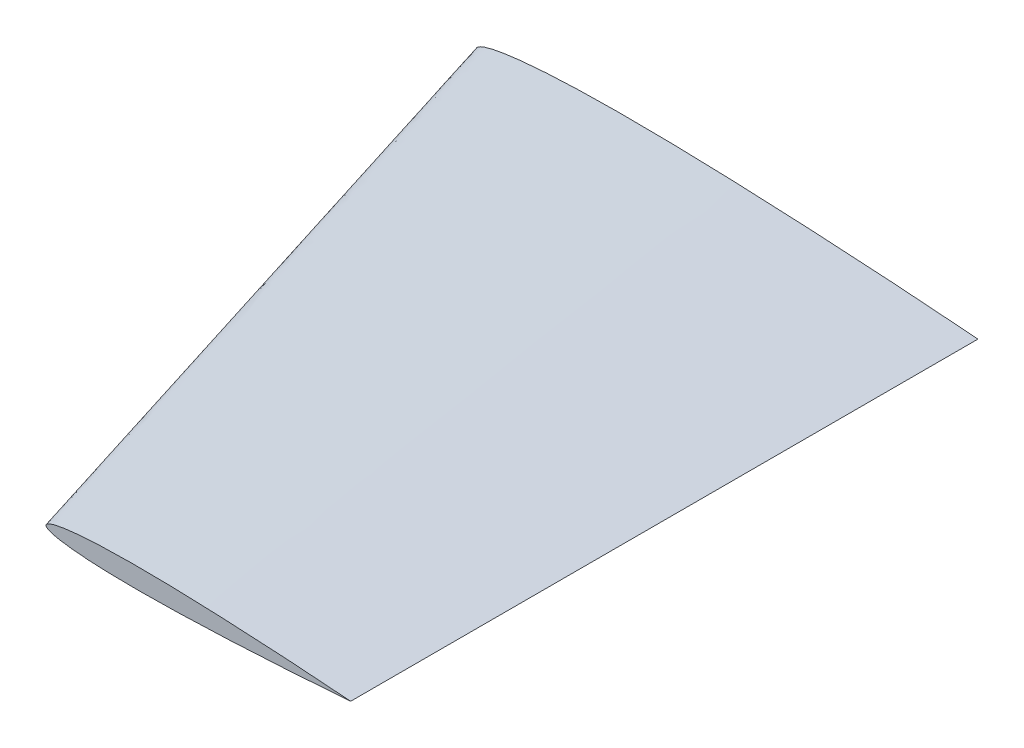
from build123d import *


with BuildPart() as part:
    # нерв1 → По сечениям1 section 0
    with BuildSketch(Plane.XY):
        with BuildLine():
            add(Edge.make_bspline(
                [(0, 0), (0.066646533, -0.300327221), (0.220118621, -0.991913766), (1.207915471, -1.818791265), (2.598597736, -2.607301109), (4.546714277, -3.365105983), (7.004632242, -4.097551663), (9.987947916, -4.797726988), (13.479893141, -5.462475269), (17.470424185, -6.085824188), (21.943527985, -6.664374922), (26.881916231, -7.193782765), (32.266470883, -7.670167284), (38.075817074, -8.090755343), (44.287387024, -8.452247623), (50.876432941, -8.753613633), (57.81725763, -8.993112623), (65.082247917, -9.170073671), (72.64284552, -9.285223373), (80.46919796, -9.339560237), (88.530513531, -9.334786425), (96.79487635, -9.272994239), (105.229626265, -9.157395726), (113.801545369, -8.991353507), (122.476931474, -8.778200356), (131.22146838, -8.522939041), (140.000603953, -8.228979864), (148.779723415, -7.900978204), (157.524225798, -7.543694044), (166.199521999, -7.160257872), (174.771348337, -6.756689382), (183.205960174, -6.335952936), (191.470121888, -5.901945974), (199.531216413, -5.459578572), (207.357290435, -5.012110272), (214.917551941, -4.563316484), (222.182116321, -4.116639832), (229.122475741, -3.676441417), (235.710916968, -3.245099817), (241.921757948, -2.827375405), (247.73025644, -2.426629026), (253.113660092, -2.045299058), (258.050601159, -1.688141593), (262.5217746, -1.35751626), (266.509324011, -1.057363689), (269.997602529, -0.789959213), (272.972836194, -0.558626284), (275.423392219, -0.366201697), (277.339373331, -0.213600606), (278.713327636, -0.103768487), (279.539880848, -0.037322177), (279.907880448, -0.0074722), (280, 0)],
                knots=[0, 0, 0, 0, 0.003198495, 0.00736542, 0.013021967, 0.020363842, 0.029458972, 0.040319396, 0.052931016, 0.067263992, 0.083271473, 0.100901245, 0.120088157, 0.140764935, 0.162851426, 0.186267029, 0.210920603, 0.236719652, 0.263562421, 0.29134679, 0.31996535, 0.349305423, 0.379252048, 0.409688994, 0.440496812, 0.471554783, 0.502739083, 0.533927662, 0.564998336, 0.59582691, 0.626291899, 0.656272958, 0.685652615, 0.714314232, 0.742143266, 0.769030095, 0.794870025, 0.81955827, 0.842999124, 0.865097589, 0.885768746, 0.904927723, 0.922501305, 0.938417454, 0.952614935, 0.965034623, 0.975629178, 0.984356351, 0.991180052, 0.996072937, 0.999016957, 1, 1, 1, 1], degree=3))
            add(Edge.make_bspline(
                [(280, 0), (279.907880448, 0.0074722), (279.539880848, 0.037322177), (278.713327636, 0.103768487), (277.339373331, 0.213600606), (275.423392219, 0.366201697), (272.972836194, 0.558626284), (269.997602529, 0.789959213), (266.509324011, 1.057363689), (262.5217746, 1.35751626), (258.050601159, 1.688141593), (253.113660092, 2.045299058), (247.73025644, 2.426629026), (241.921757948, 2.827375405), (235.710916968, 3.245099817), (229.122475741, 3.676441417), (222.182116321, 4.116639832), (214.917551941, 4.563316484), (207.357290435, 5.012110272), (199.531216413, 5.459578572), (191.470121888, 5.901945974), (183.205960174, 6.335952936), (174.771348337, 6.756689382), (166.199521999, 7.160257872), (157.524225798, 7.543694044), (148.779723415, 7.900978204), (140.000603953, 8.228979864), (131.22146838, 8.522939041), (122.476931474, 8.778200356), (113.801545369, 8.991353507), (105.229626265, 9.157395726), (96.79487635, 9.272994239), (88.530513531, 9.334786425), (80.46919796, 9.339560237), (72.64284552, 9.285223373), (65.082247917, 9.170073671), (57.81725763, 8.993112623), (50.876432941, 8.753613633), (44.287387024, 8.452247623), (38.075817074, 8.090755343), (32.266470883, 7.670167284), (26.881916231, 7.193782765), (21.943527985, 6.664374922), (17.470424185, 6.085824188), (13.479893141, 5.462475269), (9.987947916, 4.797726988), (7.004632242, 4.097551663), (4.546714277, 3.365105983), (2.598597736, 2.607301109), (1.207915471, 1.818791265), (0.220118621, 0.991913766), (0.066646533, 0.300327221), (0, 0)],
                knots=[0, 0, 0, 0, 0.000983043, 0.003927063, 0.008819948, 0.015643649, 0.024370822, 0.034965377, 0.047385065, 0.061582546, 0.077498695, 0.095072277, 0.114231254, 0.134902411, 0.157000876, 0.18044173, 0.205129975, 0.230969905, 0.257856734, 0.285685768, 0.314347385, 0.343727042, 0.373708101, 0.40417309, 0.435001664, 0.466072338, 0.497260917, 0.528445217, 0.559503188, 0.590311006, 0.620747952, 0.650694577, 0.68003465, 0.70865321, 0.736437579, 0.763280348, 0.789079397, 0.813732971, 0.837148574, 0.859235065, 0.879911843, 0.899098755, 0.916728527, 0.932736008, 0.947068984, 0.959680604, 0.970541028, 0.979636158, 0.986978033, 0.99263458, 0.996801505, 1, 1, 1, 1], degree=3))
        make_face()
    # нерв 2 → По сечениям1 section 1
    with BuildSketch(Plane.XY.offset(175)):
        with BuildLine():
            add(Edge.make_bspline(
                [(55, 0), (55.05355525, -0.241334374), (55.176881034, -0.797073562), (55.970646361, -1.461528695), (57.088158895, -2.095152677), (58.653609687, -2.704103022), (60.628722338, -3.292675444), (63.026029575, -3.85531633), (65.832056988, -4.389489056), (69.03873372, -4.890394437), (72.633192131, -5.355301277), (76.601539829, -5.780718293), (80.928414103, -6.163527282), (85.59663872, -6.50149983), (90.588078859, -6.791984697), (95.882847899, -7.034153812), (101.46029631, -7.226608358), (107.298234933, -7.3688092), (113.37371515, -7.46134021), (119.66274836, -7.505003762), (126.140591231, -7.501167663), (132.781597067, -7.451513228), (139.559521106, -7.358621566), (146.447670386, -7.225194782), (153.418962791, -7.053911), (160.445822806, -6.8487903), (167.500485319, -6.612573105), (174.555134887, -6.349000342), (181.581967159, -6.061897), (188.553187321, -5.753778647), (195.441262056, -5.429482539), (202.21907514, -5.091390752), (208.859919374, -4.742635158), (215.337584618, -4.387161352), (221.6263941, -4.027588612), (227.701604239, -3.666950746), (233.539200615, -3.308014151), (239.116275149, -2.954283282), (244.410558278, -2.607669496), (249.401412637, -2.271998093), (254.068956068, -1.949969753), (258.394905431, -1.643543886), (262.362090217, -1.356542351), (265.954997447, -1.09086128), (269.159278223, -0.84966725), (271.962359175, -0.634788654), (274.353171942, -0.448896121), (276.322368747, -0.29426922), (277.861996427, -0.171643344), (278.96606685, -0.083385391), (279.630261396, -0.029991035), (279.92597536, -0.006004446), (280, 0)],
                knots=[0, 0, 0, 0, 0.003198495, 0.00736542, 0.013021967, 0.020363842, 0.029458972, 0.040319396, 0.052931016, 0.067263992, 0.083271473, 0.100901245, 0.120088157, 0.140764935, 0.162851426, 0.186267029, 0.210920603, 0.236719652, 0.263562421, 0.29134679, 0.31996535, 0.349305423, 0.379252048, 0.409688994, 0.440496812, 0.471554783, 0.502739083, 0.533927662, 0.564998336, 0.59582691, 0.626291899, 0.656272958, 0.685652615, 0.714314232, 0.742143266, 0.769030095, 0.794870025, 0.81955827, 0.842999124, 0.865097589, 0.885768746, 0.904927723, 0.922501305, 0.938417454, 0.952614935, 0.965034623, 0.975629178, 0.984356351, 0.991180052, 0.996072937, 0.999016957, 1, 1, 1, 1], degree=3))
            add(Edge.make_bspline(
                [(280, 0), (279.92597536, 0.006004446), (279.630261396, 0.029991035), (278.96606685, 0.083385391), (277.861996427, 0.171643344), (276.322368747, 0.29426922), (274.353171942, 0.448896121), (271.962359175, 0.634788654), (269.159278223, 0.84966725), (265.954997447, 1.09086128), (262.362090217, 1.356542351), (258.394905431, 1.643543886), (254.068956068, 1.949969753), (249.401412637, 2.271998093), (244.410558278, 2.607669496), (239.116275149, 2.954283282), (233.539200615, 3.308014151), (227.701604239, 3.666950746), (221.6263941, 4.027588612), (215.337584618, 4.387161352), (208.859919374, 4.742635158), (202.21907514, 5.091390752), (195.441262056, 5.429482539), (188.553187321, 5.753778647), (181.581967159, 6.061897), (174.555134887, 6.349000342), (167.500485319, 6.612573105), (160.445822806, 6.8487903), (153.418962791, 7.053911), (146.447670386, 7.225194782), (139.559521106, 7.358621566), (132.781597067, 7.451513228), (126.140591231, 7.501167663), (119.66274836, 7.505003762), (113.37371515, 7.46134021), (107.298234933, 7.3688092), (101.46029631, 7.226608358), (95.882847899, 7.034153812), (90.588078859, 6.791984697), (85.59663872, 6.50149983), (80.928414103, 6.163527282), (76.601539829, 5.780718293), (72.633192131, 5.355301277), (69.03873372, 4.890394437), (65.832056988, 4.389489056), (63.026029575, 3.85531633), (60.628722338, 3.292675444), (58.653609687, 2.704103022), (57.088158895, 2.095152677), (55.970646361, 1.461528695), (55.176881034, 0.797073562), (55.05355525, 0.241334374), (55, 0)],
                knots=[0, 0, 0, 0, 0.000983043, 0.003927063, 0.008819948, 0.015643649, 0.024370822, 0.034965377, 0.047385065, 0.061582546, 0.077498695, 0.095072277, 0.114231254, 0.134902411, 0.157000876, 0.18044173, 0.205129975, 0.230969905, 0.257856734, 0.285685768, 0.314347385, 0.343727042, 0.373708101, 0.40417309, 0.435001664, 0.466072338, 0.497260917, 0.528445217, 0.559503188, 0.590311006, 0.620747952, 0.650694577, 0.68003465, 0.70865321, 0.736437579, 0.763280348, 0.789079397, 0.813732971, 0.837148574, 0.859235065, 0.879911843, 0.899098755, 0.916728527, 0.932736008, 0.947068984, 0.959680604, 0.970541028, 0.979636158, 0.986978033, 0.99263458, 0.996801505, 1, 1, 1, 1], degree=3))
        make_face()
    # нерв 3 → По сечениям1 section 2
    with BuildSketch(Plane.XY.offset(350)):
        with BuildLine():
            add(Edge.make_bspline(
                [(280, 0), (279.944070272, 0.004536693), (279.720641943, 0.022659893), (279.218806065, 0.063002296), (278.384619522, 0.129686082), (277.221345276, 0.222336744), (275.733507689, 0.339165958), (273.927115821, 0.479618094), (271.809232435, 0.641970811), (269.388220293, 0.8242063), (266.673579275, 1.02494311), (263.67615077, 1.241788714), (260.407655696, 1.47331048), (256.881067326, 1.716620782), (253.110199588, 1.970239175), (249.110074557, 2.232125146), (244.896284909, 2.49938847), (240.485656536, 2.770585008), (235.895497764, 3.043066951), (231.143952822, 3.314744133), (226.249716861, 3.583324341), (221.232190106, 3.846828568), (216.111175776, 4.102275696), (210.906852643, 4.347299422), (205.63970852, 4.580099955), (200.330546359, 4.797022481), (195.000366686, 4.996166346), (189.670177231, 5.17464156), (184.360994109, 5.329621645), (179.093795402, 5.459036058), (173.889415947, 5.559847405), (168.768317784, 5.630032217), (163.75066893, 5.667548901), (158.856298761, 5.670447287), (154.10458478, 5.637457048), (149.51422195, 5.567544729), (145.10333499, 5.460104093), (140.889262857, 5.314693991), (136.888770693, 5.131721771), (133.117460366, 4.912244316), (129.590357322, 4.65688728), (126.321163426, 4.367653821), (123.322856277, 4.046227631), (120.607043255, 3.694964685), (118.184220836, 3.316502842), (116.064111235, 2.912905672), (114.252812433, 2.487799224), (112.760505097, 2.043100061), (111.577720054, 1.583004244), (110.73337725, 1.104266125), (110.133643448, 0.602233358), (110.040463967, 0.182341527), (110, 0)],
                knots=[0, 0, 0, 0, 0.000983043, 0.003927063, 0.008819948, 0.015643649, 0.024370822, 0.034965377, 0.047385065, 0.061582546, 0.077498695, 0.095072277, 0.114231254, 0.134902411, 0.157000876, 0.18044173, 0.205129975, 0.230969905, 0.257856734, 0.285685768, 0.314347385, 0.343727042, 0.373708101, 0.40417309, 0.435001664, 0.466072338, 0.497260917, 0.528445217, 0.559503188, 0.590311006, 0.620747952, 0.650694577, 0.68003465, 0.70865321, 0.736437579, 0.763280348, 0.789079397, 0.813732971, 0.837148574, 0.859235065, 0.879911843, 0.899098755, 0.916728527, 0.932736008, 0.947068984, 0.959680604, 0.970541028, 0.979636158, 0.986978033, 0.99263458, 0.996801505, 1, 1, 1, 1], degree=3))
            add(Edge.make_bspline(
                [(110, 0), (110.040463967, -0.182341527), (110.133643448, -0.602233358), (110.73337725, -1.104266125), (111.577720054, -1.583004244), (112.760505097, -2.043100061), (114.252812433, -2.487799224), (116.064111235, -2.912905672), (118.184220836, -3.316502842), (120.607043255, -3.694964685), (123.322856277, -4.046227631), (126.321163426, -4.367653821), (129.590357322, -4.65688728), (133.117460366, -4.912244316), (136.888770693, -5.131721771), (140.889262857, -5.314693991), (145.10333499, -5.460104093), (149.51422195, -5.567544729), (154.10458478, -5.637457048), (158.856298761, -5.670447287), (163.75066893, -5.667548901), (168.768317784, -5.630032217), (173.889415947, -5.559847405), (179.093795402, -5.459036058), (184.360994109, -5.329621645), (189.670177231, -5.17464156), (195.000366686, -4.996166346), (200.330546359, -4.797022481), (205.63970852, -4.580099955), (210.906852643, -4.347299422), (216.111175776, -4.102275696), (221.232190106, -3.846828568), (226.249716861, -3.583324341), (231.143952822, -3.314744133), (235.895497764, -3.043066951), (240.485656536, -2.770585008), (244.896284909, -2.49938847), (249.110074557, -2.232125146), (253.110199588, -1.970239175), (256.881067326, -1.716620782), (260.407655696, -1.47331048), (263.67615077, -1.241788714), (266.673579275, -1.02494311), (269.388220293, -0.8242063), (271.809232435, -0.641970811), (273.927115821, -0.479618094), (275.733507689, -0.339165958), (277.221345276, -0.222336744), (278.384619522, -0.129686082), (279.218806065, -0.063002296), (279.720641943, -0.022659893), (279.944070272, -0.004536693), (280, 0)],
                knots=[0, 0, 0, 0, 0.003198495, 0.00736542, 0.013021967, 0.020363842, 0.029458972, 0.040319396, 0.052931016, 0.067263992, 0.083271473, 0.100901245, 0.120088157, 0.140764935, 0.162851426, 0.186267029, 0.210920603, 0.236719652, 0.263562421, 0.29134679, 0.31996535, 0.349305423, 0.379252048, 0.409688994, 0.440496812, 0.471554783, 0.502739083, 0.533927662, 0.564998336, 0.59582691, 0.626291899, 0.656272958, 0.685652615, 0.714314232, 0.742143266, 0.769030095, 0.794870025, 0.81955827, 0.842999124, 0.865097589, 0.885768746, 0.904927723, 0.922501305, 0.938417454, 0.952614935, 0.965034623, 0.975629178, 0.984356351, 0.991180052, 0.996072937, 0.999016957, 1, 1, 1, 1], degree=3))
        make_face()
    loft()


solid = part.part
